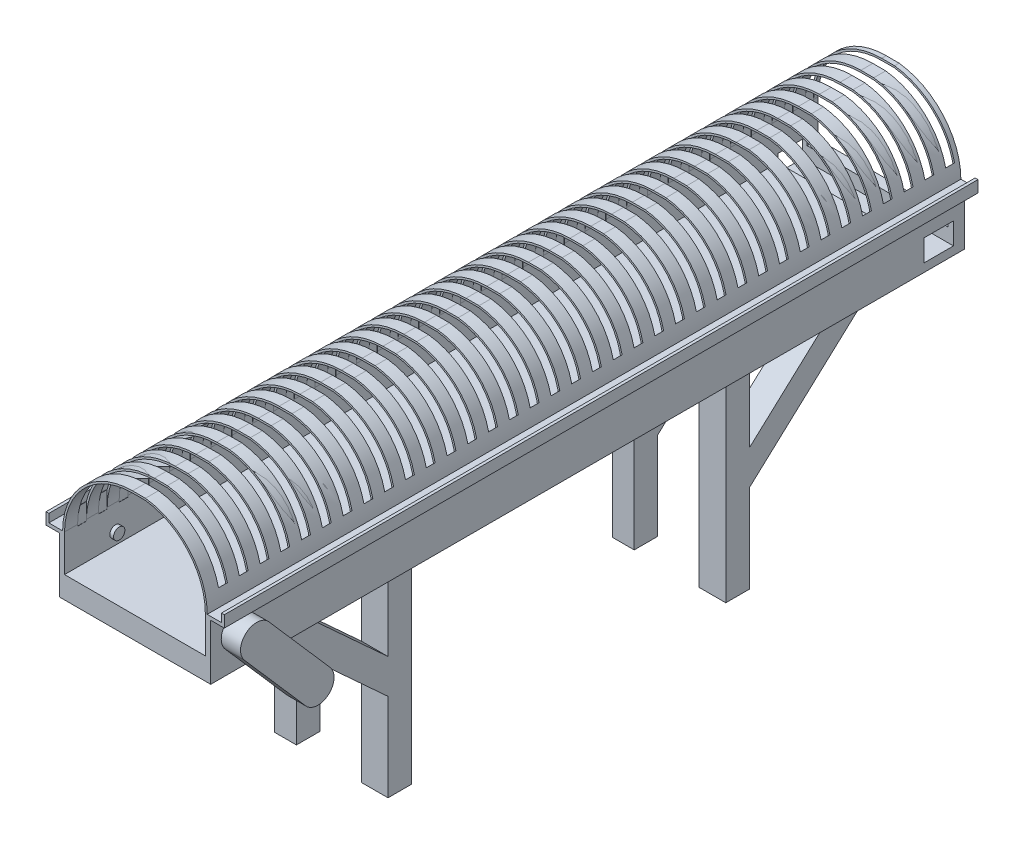
from build123d import *

# Parameters (mm, degrees)
CROQUIS1_W                   = 800
CROQUIS1_H                   = 3990
SALIENTE_EXTRUIR1_DEPTH      = 340
SALIENTE_EXTRUIR2_DEPTH      = 3990
CORTAR_EXTRUIR1_DEPTH        = 3990
SALIENTE_EXTRUIR4_DEPTH      = 3990
CROQUIS5_W                   = 746.991691775
CROQUIS5_H                   = 46.851770837
CORTAR_EXTRUIR2_DEPTH        = 377
MATRIZL1_COUNT               = 36
MATRIZL1_PITCH               = 110
CROQUIS6_R                   = 30
CROQUIS7_W                   = 155.560193976
CROQUIS7_H                   = 114.81823841
CORTAR_EXTRUIR3_DEPTH        = 971
SALIENTE_EXTRUIR5_DEPTH      = 102
SALIENTE_EXTRUIR6_DEPTH      = 300
SALIENTE_EXTRUIR6_DEPTH_BACK = 300
CROQUIS10_W                  = 343.544442909
CROQUIS10_H                  = 1212.128506112
CORTAR_EXTRUIR4_DEPTH        = 4000


with BuildPart() as part:
    # Croquis1 → Saliente-Extruir1 (new body)
    with BuildSketch(Plane(origin=(0, 0, 0), x_dir=(1, 0, 0), z_dir=(0, 1, 0))):
        Rectangle(CROQUIS1_W, CROQUIS1_H)
    extrude(amount=SALIENTE_EXTRUIR1_DEPTH)

    # Croquis2 → Saliente-Extruir2 (add)
    with BuildSketch(Plane.XY.offset(1995)):
        Polygon((-400, 293.833518803), (-472.072530244, 293.833518803), (-472.072530244, 355.408196661), (-457.020942323, 355.408196661), (-457.020942323, 311.621759073), (-400, 311.621759073), align=None)
        Polygon((457.020942323, 311.621759073), (400, 311.621759073), (400, 293.833518803), (472.072530244, 293.833518803), (472.072530244, 355.408196661), (457.020942323, 355.408196661), align=None)
    extrude(amount=-SALIENTE_EXTRUIR2_DEPTH)

    # Croquis3 → Cortar-Extruir1 (cut)
    with BuildSketch(Plane.XY.offset(1995)):
        Polygon((-400, 311.621759073), (-374.055337229, 311.621759073), (-374.055337229, 116.177146046), (371.3773647, 116.177146046), (371.3773647, 311.621759073), (400.001629705, 311.621759073), (400, 340), (-400, 340), align=None)
    extrude(amount=-CORTAR_EXTRUIR1_DEPTH, mode=Mode.SUBTRACT)

    # Croquis4 → Saliente-Extruir4 (add)
    with BuildSketch(Plane.XY.offset(1995)):
        with BuildLine():
            Line((-14.048934213, 670.355723046), (53.743904973, 670.355723046))
            ThreePointArc((53.743904973, 670.355723046), (280.557179164, 551.194854206), (371.3773647, 311.621759073))
            Line((371.3773647, 311.621759073), (381.3773647, 311.621759073))
            ThreePointArc((381.3773647, 311.621759073), (287.841241942, 558.052950419), (54.347408754, 680.355723046))
            Line((54.347408754, 680.355723046), (-14.048934213, 680.355723046))
            ThreePointArc((-14.048934213, 680.355723046), (-275.22096446, 572.445477822), (-384.055274545, 311.657166436))
            Line((-384.055274545, 311.657166436), (-384.055274545, 311.621759073))
            Line((-384.055274545, 311.621759073), (-374.055337229, 311.621759073))
            ThreePointArc((-374.055337229, 311.621759073), (-268.162426142, 565.361902678), (-14.048934213, 670.355723046))
        make_face()
    extrude(amount=-SALIENTE_EXTRUIR4_DEPTH)

    # Croquis5 → Cortar-Extruir2 (cut)
    with BuildSketch(Plane(origin=(0, 680.355723046, 0), x_dir=(1, 0, 0), z_dir=(0, 1, 0))):
        with Locations((-1.390772309, -1902.434075919)):
            Rectangle(CROQUIS5_W, CROQUIS5_H)
    cortar_extruir2 = extrude(amount=-CORTAR_EXTRUIR2_DEPTH, mode=Mode.SUBTRACT)

    # MatrizL1: Cortar-Extruir2 ×36
    with Locations(*[(0, 0, -i * MATRIZL1_PITCH) for i in range(1, MATRIZL1_COUNT)]):
        add(cortar_extruir2, mode=Mode.SUBTRACT)

    # Barrer2: sweep along a curve in space
    with BuildLine() as barrer2_path:
        Line((-400, 144.32741232, -250.302273851), (-444.623067862, 144.32741232, -250.302273851))
        ThreePointArc((-444.623067862, 144.32741232, -250.302273851), (-479.978406922, 141.351721311, -235.963119166), (-494.623067862, 134.167767719, -201.345337452))
        Line((-494.623067862, 134.167767719, -201.345337452), (-494.623067862, -59.014673463, 729.555383787))
        ThreePointArc((-494.623067862, -59.014673463, 729.555383787), (-494.623067862, -59.817812911, 744.60735419), (-494.623067862, -56.098620403, 759.214696626))
        Line((-494.623067862, -56.098620403, 759.214696626), (-494.623067862, 175.62982253, 1306.351297995))
        ThreePointArc((-494.623067862, 175.62982253, 1306.351297995), (-494.623067862, 178.589164532, 1315.902201659), (-494.623067862, 179.588939191, 1325.850966232))
        Line((-494.623067862, 179.588939191, 1325.850966232), (-494.623067862, 179.588939191, 1675.374466695))
        ThreePointArc((-494.623067862, 179.588939191, 1675.374466695), (-479.978406922, 179.588939191, 1710.729805754), (-444.623067862, 179.588939191, 1725.374466695))
        Line((-444.623067862, 179.588939191, 1725.374466695), (-354.105566912, 179.588939191, 1725.374466695))
    # Croquis6 → Barrer2 (sweep)
    with BuildSketch(Plane.ZY.offset(400)):
        with Locations((-250.302273851, 144.32741232)):
            Circle(CROQUIS6_R)
    sweep(path=barrer2_path.line)

    # Croquis7 → Cortar-Extruir3 (cut)
    with BuildSketch(Plane.ZY.offset(400)):
        with Locations((-1859.357448484, 101.488067983)):
            Rectangle(CROQUIS7_W, CROQUIS7_H)
    extrude(amount=-CORTAR_EXTRUIR3_DEPTH, mode=Mode.SUBTRACT)

    # Croquis8 → Saliente-Extruir5 (add)
    with BuildSketch(Plane(origin=(400, 0, 0), x_dir=(0, 0, -1), z_dir=(1, 0, 0))):
        with BuildLine():
            Line((-1789.661975158, 235.354686138), (-1465.264235988, -136.057218128))
            ThreePointArc((-1465.264235988, -136.057218128), (-1473.404754486, -256.536891892), (-1593.884428249, -248.396373394))
            Line((-1593.884428249, -248.396373394), (-1918.282167419, 123.015530872))
            ThreePointArc((-1918.282167419, 123.015530872), (-1910.141648921, 243.495204636), (-1789.661975158, 235.354686138))
        make_face()
    extrude(amount=SALIENTE_EXTRUIR5_DEPTH)

    # Croquis9 → Saliente-Extruir6 (add, two sides: drawn at the far end of the back side and taken through both)
    with BuildSketch(Plane(origin=(0, 0, 0), x_dir=(0, 0, -1), z_dir=(1, 0, 0)).offset(-SALIENTE_EXTRUIR6_DEPTH_BACK)):
        Polygon((1637.294822829, 0), (956.443968025, -624.298083146), (956.443968025, -1089.644276544), (831.898079951, -1089.644276544), (831.898079951, 0), (956.443968025, 0), (956.443968025, -441.630780638), (1438.080389188, 0), align=None)
        Polygon((-1438.080389188, 0), (-1637.294822829, 0), (-956.443968025, -624.298083146), (-956.443968025, -1089.644276544), (-831.898079951, -1089.644276544), (-831.898079951, 0), (-956.443968025, 0), (-956.443968025, -441.630780638), align=None)
    extrude(amount=SALIENTE_EXTRUIR6_DEPTH + SALIENTE_EXTRUIR6_DEPTH_BACK)

    # Croquis10 → Cortar-Extruir4 (cut)
    with BuildSketch(Plane(origin=(0, 0, -1995), x_dir=(-1, 0, 0), z_dir=(0, 0, -1))):
        with Locations((13.058932638, -662.824312163)):
            Rectangle(CROQUIS10_W, CROQUIS10_H)
    extrude(amount=-CORTAR_EXTRUIR4_DEPTH, mode=Mode.SUBTRACT)


solid = part.part
